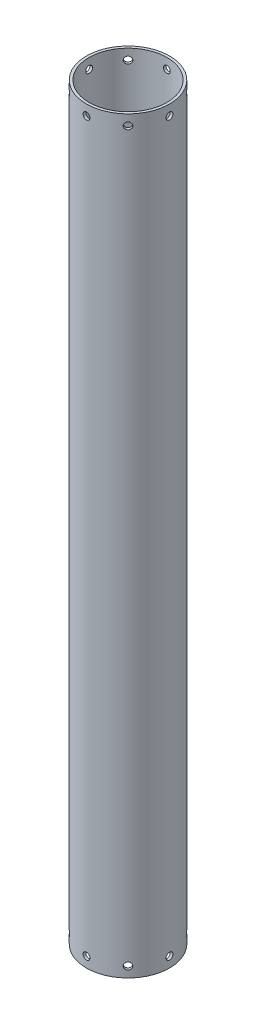
from build123d import *

# Parameters (mm, degrees)
SKETCH1_R                                 = 50.8
SKETCH1_R_2                               = 47.625
BOSS_EXTRUDE1_DEPTH                       = 914.4
F_21_64_0_32813_DIAMETER_HOLE1_AT_2_COUNT = 2
F_21_64_0_32813_DIAMETER_HOLE1_AT_2_PITCH = 889
CIRPATTERN1_COUNT                         = 8
F_1_2_1_2_DIAMETER_HOLE1_REACH            = 923.429
F_1_2_1_2_DIAMETER_HOLE1_BORE_R           = 0.6


with BuildPart() as part:
    # Sketch1 → Boss-Extrude1 (new body)
    with BuildSketch(Plane(origin=(0, 0, 0), x_dir=(1, 0, 0), z_dir=(0, 1, 0))):
        with Locations(Location((0, 0, 0), (0, 0, 270))):
            Circle(SKETCH1_R)
        with Locations(Location((0, 0, 0), (0, 0, 270))):
            Circle(SKETCH1_R_2, mode=Mode.SUBTRACT)
    extrude(amount=BOSS_EXTRUDE1_DEPTH)

    # Sketch3 → 21/64 (0.32813) Diameter Hole1 (revolve, cut)
    with BuildSketch(Plane(origin=(0, 12.7, 50.8), x_dir=(0, -1, 0), z_dir=(1, 0, 0))):
        Polygon((0, 0), (0, 7.62), (4.167251, 5.116062984), (4.167251, 0), align=None)
    f_21_64_0_32813_diameter_hole1 = revolve(axis=Axis((0, 12.7, 57.15), (0, 0, -1)), mode=Mode.SUBTRACT)

    # 21/64 (0.32813) Diameter Hole1 at 2: 21/64 (0.32813) Diameter Hole1 ×2
    with Locations(*[(0, i * F_21_64_0_32813_DIAMETER_HOLE1_AT_2_PITCH, 0) for i in range(1, F_21_64_0_32813_DIAMETER_HOLE1_AT_2_COUNT)]):
        add(f_21_64_0_32813_diameter_hole1, mode=Mode.SUBTRACT)

    # CirPattern1: 21/64 (0.32813) Diameter Hole1 ×8 about axis
    cirpattern1_axis = Axis((0, 914.4, 0), (0, -1, 0))
    for i in range(1, CIRPATTERN1_COUNT):
        add(f_21_64_0_32813_diameter_hole1.rotate(cirpattern1_axis, i * 360 / CIRPATTERN1_COUNT), mode=Mode.SUBTRACT)

    # CirPattern1 copy 1 sketch → CirPattern1 copy 1 (revolve, cut)
    with BuildSketch(Plane(origin=(-35.921024484, 901.7, 35.921024484), x_dir=(0, -1, 0), z_dir=(0.7071067811865476, 0, 0.7071067811865475))):
        Polygon((0, 0), (0, 7.62), (4.167251, 5.116062984), (4.167251, 0), align=None)
    revolve(axis=Axis((-40.411152545, 901.7, 40.411152545), (0.7071067811865475, 0, -0.7071067811865476)), mode=Mode.SUBTRACT)

    # CirPattern1 copy 2 sketch → CirPattern1 copy 2 (revolve, cut)
    with BuildSketch(Plane(origin=(-50.8, 901.7, 0), x_dir=(0, -1, 0), z_dir=(0, 0, 1))):
        Polygon((0, 0), (0, 7.62), (4.167251, 5.116062984), (4.167251, 0), align=None)
    revolve(axis=Axis((-57.15, 901.7, 0), (1, 0, 0)), mode=Mode.SUBTRACT)

    # CirPattern1 copy 3 sketch → CirPattern1 copy 3 (revolve, cut)
    with BuildSketch(Plane(origin=(-35.921024484, 901.7, -35.921024484), x_dir=(0, -1, 0), z_dir=(-0.7071067811865475, 0, 0.7071067811865476))):
        Polygon((0, 0), (0, 7.62), (4.167251, 5.116062984), (4.167251, 0), align=None)
    revolve(axis=Axis((-40.411152545, 901.7, -40.411152545), (0.7071067811865476, 0, 0.7071067811865475)), mode=Mode.SUBTRACT)

    # CirPattern1 copy 4 sketch → CirPattern1 copy 4 (revolve, cut)
    with BuildSketch(Plane(origin=(0, 901.7, -50.8), x_dir=(0, -1, 0), z_dir=(-1, 0, 0))):
        Polygon((0, 0), (0, 7.62), (4.167251, 5.116062984), (4.167251, 0), align=None)
    revolve(axis=Axis((0, 901.7, -57.15), (0, 0, 1)), mode=Mode.SUBTRACT)

    # CirPattern1 copy 5 sketch → CirPattern1 copy 5 (revolve, cut)
    with BuildSketch(Plane(origin=(35.921024484, 901.7, -35.921024484), x_dir=(0, -1, 0), z_dir=(-0.7071067811865477, 0, -0.7071067811865475))):
        Polygon((0, 0), (0, 7.62), (4.167251, 5.116062984), (4.167251, 0), align=None)
    revolve(axis=Axis((40.411152545, 901.7, -40.411152545), (-0.7071067811865475, 0, 0.7071067811865477)), mode=Mode.SUBTRACT)

    # CirPattern1 copy 6 sketch → CirPattern1 copy 6 (revolve, cut)
    with BuildSketch(Plane(origin=(50.8, 901.7, 0), x_dir=(0, -1, 0), z_dir=(0, 0, -1))):
        Polygon((0, 0), (0, 7.62), (4.167251, 5.116062984), (4.167251, 0), align=None)
    revolve(axis=Axis((57.15, 901.7, 0), (-1, 0, 0)), mode=Mode.SUBTRACT)

    # CirPattern1 copy 7 sketch → CirPattern1 copy 7 (revolve, cut)
    with BuildSketch(Plane(origin=(35.921024484, 901.7, 35.921024484), x_dir=(0, -1, 0), z_dir=(0.7071067811865474, 0, -0.7071067811865477))):
        Polygon((0, 0), (0, 7.62), (4.167251, 5.116062984), (4.167251, 0), align=None)
    revolve(axis=Axis((40.411152545, 901.7, 40.411152545), (-0.7071067811865477, 0, -0.7071067811865474)), mode=Mode.SUBTRACT)

    # Ø1.2 (1.2) Diameter Hole1 bore → Ø1.2 (1.2) Diameter Hole1 (cut, up to next)
    with BuildSketch(Plane(origin=(0, 0, -50.8), x_dir=(-1, 0, 0), z_dir=(0, 0, -1)), mode=Mode.PRIVATE) as f_1_2_1_2_diameter_hole1_sk1:
        with Locations((0, 552.45)):
            Circle(F_1_2_1_2_DIAMETER_HOLE1_BORE_R)
    f_1_2_1_2_diameter_hole1_tool1 = extrude(f_1_2_1_2_diameter_hole1_sk1.sketch, amount=-F_1_2_1_2_DIAMETER_HOLE1_REACH, mode=Mode.PRIVATE) & part.part
    add(f_1_2_1_2_diameter_hole1_tool1.solids().sort_by_distance((0, 552.45, -50.8))[0], mode=Mode.SUBTRACT)


solid = part.part
